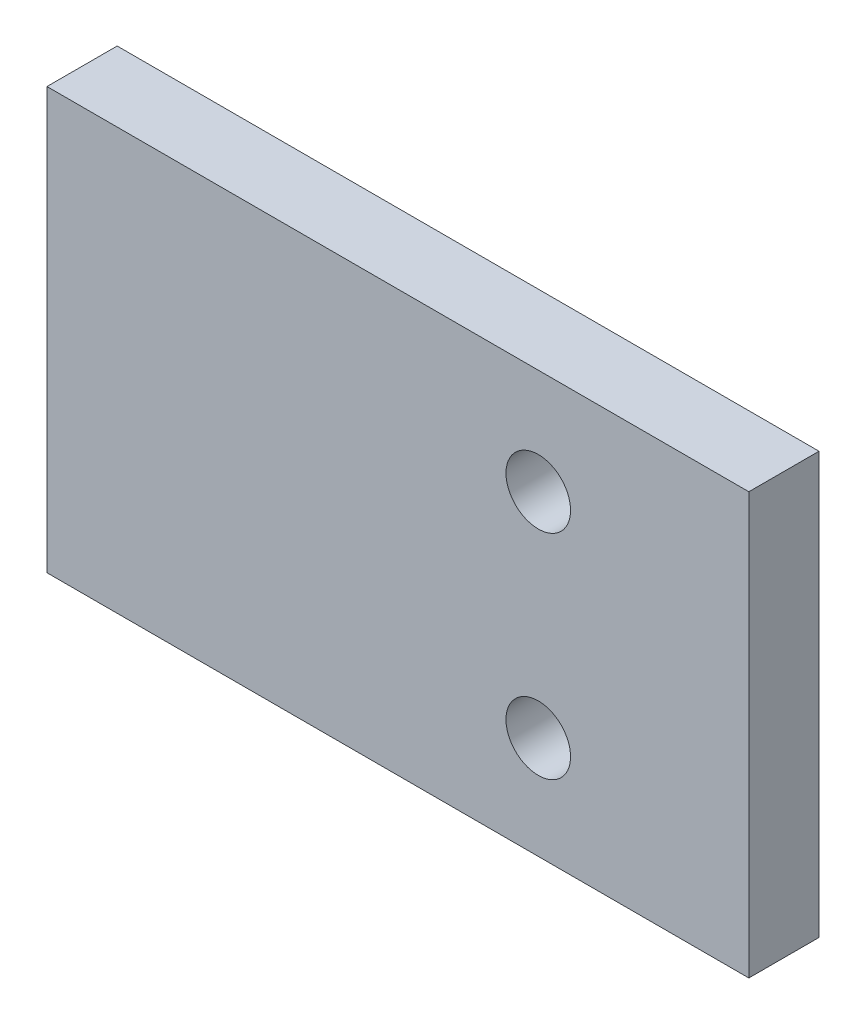
from build123d import *

# Parameters (mm, degrees)
SKETCH1_W           = 31.75
SKETCH1_H           = 19.05
BOSS_EXTRUDE2_DEPTH = 3.175
SKETCH3_R           = 1.4605
CUT_EXTRUDE1_DEPTH  = 9.525


with BuildPart() as part:
    # Sketch1 → Boss-Extrude2 (new body)
    with BuildSketch(Plane.XY):
        with Locations((-200.025, 9.525)):
            Rectangle(SKETCH1_W, SKETCH1_H)
    extrude(amount=BOSS_EXTRUDE2_DEPTH)

    # Sketch3 → Cut-Extrude1 (cut)
    with BuildSketch(Plane(origin=(0, 0, 0), x_dir=(-1, 0, 0), z_dir=(0, 0, -1))):
        with Locations((193.675, 14.2875)):
            Circle(SKETCH3_R)
        with Locations((193.675, 4.6355)):
            Circle(SKETCH3_R)
    extrude(amount=-CUT_EXTRUDE1_DEPTH, mode=Mode.SUBTRACT)


solid = part.part
